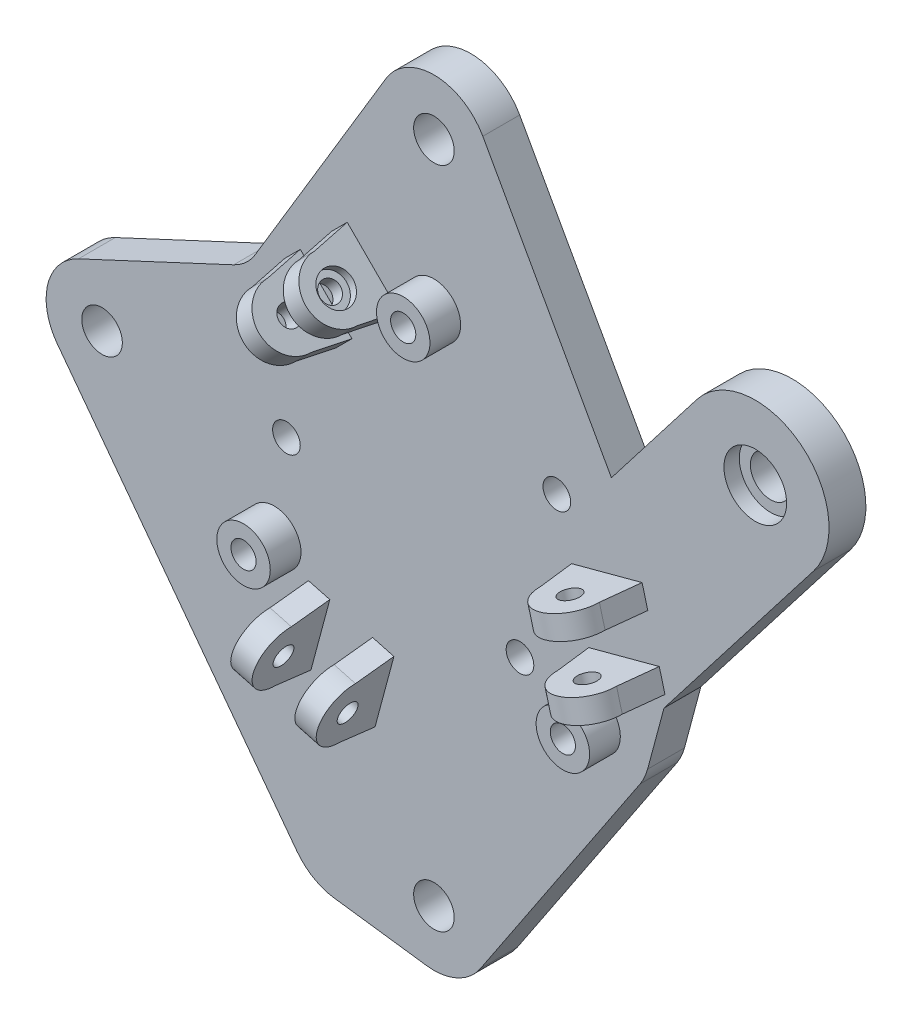
from build123d import *

# Parameters (mm, degrees)
F_01_START                                     = -12
S01_ROUNDED_V3_BACKPLATE_WITH_CAGE_AND_R       = 3.3
S01_ROUNDED_V3_BACKPLATE_WITH_CAGE_AND_R_2     = 2.25
F_01_ROUNDED_V3_BACKPLATE_WITH_CAGE_AND_DEPTH  = 6
F_02_START                                     = -6
S02_THREE_CORD_GUIDE_PEDESTALS_R               = 4.35
F_02_THREE_CORD_GUIDE_PEDESTALS_DEPTH          = 5
F_03_START                                     = -13
S03_THREE_SMOOTH_GROMMET_SEATS_R               = 2.05
F_03_THREE_SMOOTH_GROMMET_SEATS_DEPTH          = 14
F_04_START                                     = -7.2
F_04_INTEGRAL_A1_FORK_CHEEK_L_DEPTH            = 3.6
F_05_START                                     = 3.6
F_05_INTEGRAL_A1_FORK_CHEEK_R_DEPTH            = 3.6
F_06_START                                     = -7.5
S06_A1_PIVOT_THROUGH_BOTH_CHEEKS_R             = 1.65
F_06_A1_PIVOT_THROUGH_BOTH_CHEEKS_DEPTH        = 15
F_07_START                                     = -7.3
S07_A1_RECESSED_PIVOT_SCREW_HEAD_R             = 2.7
F_07_A1_RECESSED_PIVOT_SCREW_HEAD_DEPTH        = 1.5
F_08_START                                     = -7.2
F_08_INTEGRAL_A2_FORK_CHEEK_L_DEPTH            = 3.6
F_09_START                                     = 3.6
F_09_INTEGRAL_A2_FORK_CHEEK_R_DEPTH            = 3.6
F_10_START                                     = -7.5
S10_A2_PIVOT_THROUGH_BOTH_CHEEKS_R             = 1.65
F_10_A2_PIVOT_THROUGH_BOTH_CHEEKS_DEPTH        = 15
F_11_START                                     = -7.3
S11_A2_RECESSED_PIVOT_SCREW_HEAD_R             = 2.7
F_11_A2_RECESSED_PIVOT_SCREW_HEAD_DEPTH        = 1.5
F_12_START                                     = -7.2
F_12_INTEGRAL_A3_FORK_CHEEK_L_DEPTH            = 3.6
F_13_START                                     = 3.6
F_13_INTEGRAL_A3_FORK_CHEEK_R_DEPTH            = 3.6
F_14_START                                     = -7.5
S14_A3_PIVOT_THROUGH_BOTH_CHEEKS_R             = 1.65
F_14_A3_PIVOT_THROUGH_BOTH_CHEEKS_DEPTH        = 15
F_15_START                                     = -7.3
S15_A3_RECESSED_PIVOT_SCREW_HEAD_R             = 2.7
F_15_A3_RECESSED_PIVOT_SCREW_HEAD_DEPTH        = 1.5
F_16_START                                     = -12
F_16_CONTINUOUS_LAND_FOR_BUMP_END_SUPPOR_DEPTH = 6
F_17_START                                     = -12.1
S17_THROUGH_CLEARANCE_FOR_TRACK_SUPPOR_R       = 3.3
F_17_THROUGH_CLEARANCE_FOR_TRACK_SUPPORT_DEPTH = 6.2
F_18_START                                     = -8.5
S18_LOCATING_COUNTERBORE_FOR_BUMP_END_R        = 5.1
F_18_LOCATING_COUNTERBORE_FOR_BUMP_END_P_DEPTH = 2.6


with BuildPart() as part:
    # S01 - Rounded V3 backplate with cage and cassette fixings → 01 - Rounded V3 backplate with cage and cassette fixings (new body)
    with BuildSketch(Plane.XY.offset(F_01_START)):
        with BuildLine():
            Line((-61.28, -5.46), (-22.28, -57.46))
            ThreePointArc((-22.28, -57.46), (-19.599751768, -59.85189682), (-16.202689853, -61.020173896))
            Line((-16.202689853, -61.020173896), (-1.202689853, -63.020173896))
            ThreePointArc((-1.202689853, -63.020173896), (3.754538811, -62.28935693), (7.573381448, -59.045185174))
            Line((7.573381448, -59.045185174), (33.554143562, -20.045185174))
            ThreePointArc((33.554143562, -20.045185174), (34.27222658, -18.749882266), (34.770687133, -17.35525331))
            Line((34.770687133, -17.35525331), (38.789925019, -2.35525331))
            ThreePointArc((38.789925019, -2.35525331), (39.031640499, 1.113314824), (37.954831213, 4.419350674))
            Line((37.954831213, 4.419350674), (7.954831213, 58.419350674))
            ThreePointArc((7.954831213, 58.419350674), (0.151603518, 63.098737076), (-7.803185624, 58.681911374))
            Line((-7.803185624, 58.681911374), (-29.111780005, 23.167587405))
            ThreePointArc((-29.111780005, 23.167587405), (-30.615922322, 21.34087773), (-32.588639688, 20.034088329))
            Line((-32.588639688, 20.034088329), (-57.848257735, 8.246266574))
            ThreePointArc((-57.848257735, 8.246266574), (-62.827511875, 2.210211325), (-61.28, -5.46))
        make_face()
        with Locations((0, 54)):
            Circle(S01_ROUNDED_V3_BACKPLATE_WITH_CAGE_AND_R, mode=Mode.SUBTRACT)
        with Locations((-54, 0)):
            Circle(S01_ROUNDED_V3_BACKPLATE_WITH_CAGE_AND_R, mode=Mode.SUBTRACT)
        with Locations((0, -54)):
            Circle(S01_ROUNDED_V3_BACKPLATE_WITH_CAGE_AND_R, mode=Mode.SUBTRACT)
        with Locations((14, -12)):
            Circle(S01_ROUNDED_V3_BACKPLATE_WITH_CAGE_AND_R_2, mode=Mode.SUBTRACT)
        with Locations((20, 14)):
            Circle(S01_ROUNDED_V3_BACKPLATE_WITH_CAGE_AND_R_2, mode=Mode.SUBTRACT)
        with Locations((-24, 0)):
            Circle(S01_ROUNDED_V3_BACKPLATE_WITH_CAGE_AND_R_2, mode=Mode.SUBTRACT)
    extrude(amount=F_01_ROUNDED_V3_BACKPLATE_WITH_CAGE_AND_DEPTH)

    # S02 - Three cord guide pedestals → 02 - Three cord guide pedestals (add)
    with BuildSketch(Plane.XY.offset(F_02_START)):
        with Locations((25.980762114, -15)):
            Circle(S02_THREE_CORD_GUIDE_PEDESTALS_R)
        with Locations((0, 30)):
            Circle(S02_THREE_CORD_GUIDE_PEDESTALS_R)
        with Locations((-25.980762114, -15)):
            Circle(S02_THREE_CORD_GUIDE_PEDESTALS_R)
    extrude(amount=F_02_THREE_CORD_GUIDE_PEDESTALS_DEPTH)

    # S03 - Three smooth grommet seats → 03 - Three smooth grommet seats (cut)
    with BuildSketch(Plane.XY.offset(F_03_START)):
        with Locations((25.980762114, -15)):
            Circle(S03_THREE_SMOOTH_GROMMET_SEATS_R)
        with Locations((0, 30)):
            Circle(S03_THREE_SMOOTH_GROMMET_SEATS_R)
        with Locations((-25.980762114, -15)):
            Circle(S03_THREE_SMOOTH_GROMMET_SEATS_R)
    extrude(amount=F_03_THREE_SMOOTH_GROMMET_SEATS_DEPTH, mode=Mode.SUBTRACT)

    # S04 - Integral A1 fork cheek L → 04 - Integral A1 fork cheek L (add)
    with BuildSketch(Plane(origin=(2.009618943, -7.5, 0), x_dir=(0.9659258262890683, 0.25881904510252085, 0), z_dir=(-0.2588190451025208, 0.9659258262890682, 0)).offset(F_04_START)):
        with BuildLine():
            Line((35.077774789, 7), (22.877774789, 7))
            Line((22.877774789, 7), (24.027774789, 0))
            ThreePointArc((24.027774789, 0), (28.977774789, -4.95), (33.927774789, 0))
            Line((33.927774789, 0), (35.077774789, 7))
        make_face()
    extrude(amount=F_04_INTEGRAL_A1_FORK_CHEEK_L_DEPTH)

    # S05 - Integral A1 fork cheek R → 05 - Integral A1 fork cheek R (add)
    with BuildSketch(Plane(origin=(2.009618943, -7.5, 0), x_dir=(0.9659258262890683, 0.25881904510252085, 0), z_dir=(-0.2588190451025208, 0.9659258262890682, 0)).offset(F_05_START)):
        with BuildLine():
            Line((35.077774789, 7), (22.877774789, 7))
            Line((22.877774789, 7), (24.027774789, 0))
            ThreePointArc((24.027774789, 0), (28.977774789, -4.95), (33.927774789, 0))
            Line((33.927774789, 0), (35.077774789, 7))
        make_face()
    extrude(amount=F_05_INTEGRAL_A1_FORK_CHEEK_R_DEPTH)

    # S06 - A1 pivot through both cheeks → 06 - A1 pivot through both cheeks (cut)
    with BuildSketch(Plane(origin=(2.009618943, -7.5, 0), x_dir=(0.9659258262890683, 0.25881904510252085, 0), z_dir=(-0.2588190451025208, 0.9659258262890682, 0)).offset(F_06_START)):
        with Locations((28.977774789, 0)):
            Circle(S06_A1_PIVOT_THROUGH_BOTH_CHEEKS_R)
    extrude(amount=F_06_A1_PIVOT_THROUGH_BOTH_CHEEKS_DEPTH, mode=Mode.SUBTRACT)

    # S07 - A1 recessed pivot screw head → 07 - A1 recessed pivot screw head (cut)
    with BuildSketch(Plane(origin=(2.009618943, -7.5, 0), x_dir=(0.9659258262890683, 0.25881904510252085, 0), z_dir=(-0.2588190451025208, 0.9659258262890682, 0)).offset(F_07_START)):
        with Locations(Location((28.977774789, 0, 0), (0, 0, 180))):
            Circle(S07_A1_RECESSED_PIVOT_SCREW_HEAD_R)
    extrude(amount=F_07_A1_RECESSED_PIVOT_SCREW_HEAD_DEPTH, mode=Mode.SUBTRACT)

    # S08 - Integral A2 fork cheek L → 08 - Integral A2 fork cheek L (add)
    with BuildSketch(Plane(origin=(5.490381057, 5.490381057, 0), x_dir=(-0.7071067811865475, 0.7071067811865477, 0), z_dir=(-0.7071067811865477, -0.7071067811865475, 0)).offset(F_08_START)):
        with BuildLine():
            Line((35.077774789, 7), (22.877774789, 7))
            Line((22.877774789, 7), (24.027774789, 0))
            ThreePointArc((24.027774789, 0), (28.977774789, -4.95), (33.927774789, 0))
            Line((33.927774789, 0), (35.077774789, 7))
        make_face()
    extrude(amount=F_08_INTEGRAL_A2_FORK_CHEEK_L_DEPTH)

    # S09 - Integral A2 fork cheek R → 09 - Integral A2 fork cheek R (add)
    with BuildSketch(Plane(origin=(5.490381057, 5.490381057, 0), x_dir=(-0.7071067811865475, 0.7071067811865477, 0), z_dir=(-0.7071067811865477, -0.7071067811865475, 0)).offset(F_09_START)):
        with BuildLine():
            Line((35.077774789, 7), (22.877774789, 7))
            Line((22.877774789, 7), (24.027774789, 0))
            ThreePointArc((24.027774789, 0), (28.977774789, -4.95), (33.927774789, 0))
            Line((33.927774789, 0), (35.077774789, 7))
        make_face()
    extrude(amount=F_09_INTEGRAL_A2_FORK_CHEEK_R_DEPTH)

    # S10 - A2 pivot through both cheeks → 10 - A2 pivot through both cheeks (cut)
    with BuildSketch(Plane(origin=(5.490381057, 5.490381057, 0), x_dir=(-0.7071067811865475, 0.7071067811865477, 0), z_dir=(-0.7071067811865477, -0.7071067811865475, 0)).offset(F_10_START)):
        with Locations(Location((28.977774789, 0, 0), (0, 0, 180))):
            Circle(S10_A2_PIVOT_THROUGH_BOTH_CHEEKS_R)
    extrude(amount=F_10_A2_PIVOT_THROUGH_BOTH_CHEEKS_DEPTH, mode=Mode.SUBTRACT)

    # S11 - A2 recessed pivot screw head → 11 - A2 recessed pivot screw head (cut)
    with BuildSketch(Plane(origin=(5.490381057, 5.490381057, 0), x_dir=(-0.7071067811865475, 0.7071067811865477, 0), z_dir=(-0.7071067811865477, -0.7071067811865475, 0)).offset(F_11_START)):
        with Locations(Location((28.977774789, 0, 0), (0, 0, 180))):
            Circle(S11_A2_RECESSED_PIVOT_SCREW_HEAD_R)
    extrude(amount=F_11_A2_RECESSED_PIVOT_SCREW_HEAD_DEPTH, mode=Mode.SUBTRACT)

    # S12 - Integral A3 fork cheek L → 12 - Integral A3 fork cheek L (add)
    with BuildSketch(Plane(origin=(-7.5, 2.009618943, 0), x_dir=(0, 0, -1), z_dir=(0.9659258262890683, -0.25881904510252113, 0)).offset(F_12_START)):
        with BuildLine():
            Line((7, -35.077774789), (7, -22.877774789))
            Line((7, -22.877774789), (0, -24.027774789))
            ThreePointArc((0, -24.027774789), (-4.95, -28.977774789), (0, -33.927774789))
            Line((0, -33.927774789), (7, -35.077774789))
        make_face()
    extrude(amount=F_12_INTEGRAL_A3_FORK_CHEEK_L_DEPTH)

    # S13 - Integral A3 fork cheek R → 13 - Integral A3 fork cheek R (add)
    with BuildSketch(Plane(origin=(-7.5, 2.009618943, 0), x_dir=(0, 0, -1), z_dir=(0.9659258262890683, -0.25881904510252113, 0)).offset(F_13_START)):
        with BuildLine():
            Line((7, -35.077774789), (7, -22.877774789))
            Line((7, -22.877774789), (0, -24.027774789))
            ThreePointArc((0, -24.027774789), (-4.95, -28.977774789), (0, -33.927774789))
            Line((0, -33.927774789), (7, -35.077774789))
        make_face()
    extrude(amount=F_13_INTEGRAL_A3_FORK_CHEEK_R_DEPTH)

    # S14 - A3 pivot through both cheeks → 14 - A3 pivot through both cheeks (cut)
    with BuildSketch(Plane(origin=(-7.5, 2.009618943, 0), x_dir=(0, 0, -1), z_dir=(0.9659258262890683, -0.25881904510252113, 0)).offset(F_14_START)):
        with Locations(Location((0, -28.977774789, 0), (0, 0, 90))):
            Circle(S14_A3_PIVOT_THROUGH_BOTH_CHEEKS_R)
    extrude(amount=F_14_A3_PIVOT_THROUGH_BOTH_CHEEKS_DEPTH, mode=Mode.SUBTRACT)

    # S15 - A3 recessed pivot screw head → 15 - A3 recessed pivot screw head (cut)
    with BuildSketch(Plane(origin=(-7.5, 2.009618943, 0), x_dir=(0, 0, -1), z_dir=(0.9659258262890683, -0.25881904510252113, 0)).offset(F_15_START)):
        with Locations(Location((0, -28.977774789, 0), (0, 0, 90))):
            Circle(S15_A3_RECESSED_PIVOT_SCREW_HEAD_R)
    extrude(amount=F_15_A3_RECESSED_PIVOT_SCREW_HEAD_DEPTH, mode=Mode.SUBTRACT)

    # S16 - Continuous land for bump end support → 16 - Continuous land for bump end support (add)
    with BuildSketch(Plane.XY.offset(F_16_START)):
        with BuildLine():
            Line((18.50606906, 7.339296649), (42.793274403, 38.756619219))
            ThreePointArc((42.793274403, 38.756619219), (59.626501992, 40.91125351), (61.781136283, 24.07802592))
            Line((61.781136283, 24.07802592), (37.49393094, -7.339296649))
            ThreePointArc((37.49393094, -7.339296649), (20.660703351, -9.49393094), (18.50606906, 7.339296649))
        make_face()
    extrude(amount=F_16_CONTINUOUS_LAND_FOR_BUMP_END_SUPPOR_DEPTH)

    # S17 - Through clearance for track support screw → 17 - Through clearance for track support screw (cut)
    with BuildSketch(Plane.XY.offset(F_17_START)):
        with Locations((52.287205343, 31.41732257)):
            Circle(S17_THROUGH_CLEARANCE_FOR_TRACK_SUPPOR_R)
    extrude(amount=F_17_THROUGH_CLEARANCE_FOR_TRACK_SUPPORT_DEPTH, mode=Mode.SUBTRACT)

    # S18 - Locating counterbore for bump end post → 18 - Locating counterbore for bump end post (cut)
    with BuildSketch(Plane.XY.offset(F_18_START)):
        with Locations((52.287205343, 31.41732257)):
            Circle(S18_LOCATING_COUNTERBORE_FOR_BUMP_END_R)
    extrude(amount=F_18_LOCATING_COUNTERBORE_FOR_BUMP_END_P_DEPTH, mode=Mode.SUBTRACT)


solid = part.part
